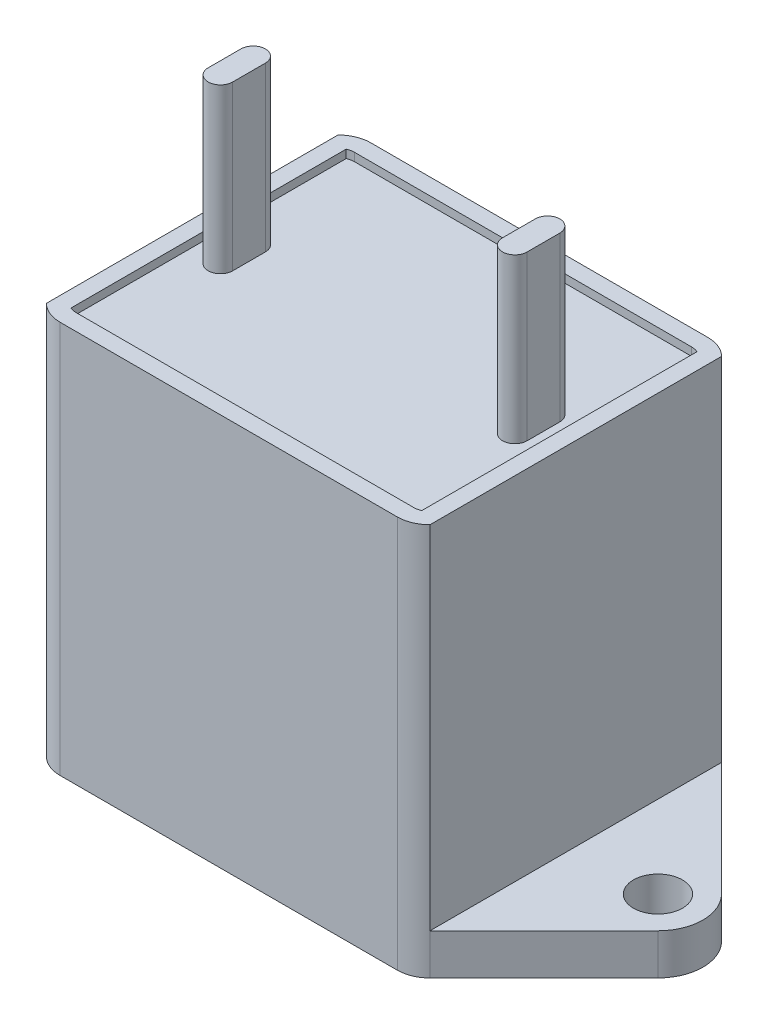
from build123d import *

# Parameters (mm, degrees)
SKETCH1_R           = 2.75
SKETCH1_R_2         = 1.5
BOSS_EXTRUDE1_DEPTH = 2.5
FILLET1_R           = 2
BOSS_EXTRUDE2_START = 21.5
BOSS_EXTRUDE2_DEPTH = 21.5
CUT_EXTRUDE1_DEPTH  = 0.5
BOSS_EXTRUDE3_DEPTH = 10


with BuildPart() as part:
    # Sketch1 → Boss-Extrude1 (new body)
    # profile 1 of 3: a face of its own
    with BuildSketch(Plane(origin=(0, 0, 0), x_dir=(1, 0, 0), z_dir=(0, 1, 0))):
        with BuildLine():
            Line((11.139087297, 9.5), (-11.139087297, 9.5))
            Line((-11.139087297, 9.5), (-18.694543648, 1.944543648))
            ThreePointArc((-18.694543648, 1.944543648), (-15.697620561, 2.540668714), (-14, 0))
            ThreePointArc((-14, 0), (-15.697620561, -2.540668714), (-18.694543648, -1.944543648))
            Line((-18.694543648, -1.944543648), (-11.139087297, -9.5))
            Line((-11.139087297, -9.5), (11.139087297, -9.5))
            Line((11.139087297, -9.5), (18.694543648, -1.944543648))
            ThreePointArc((18.694543648, -1.944543648), (14, 0), (18.694543648, 1.944543648))
            Line((18.694543648, 1.944543648), (11.139087297, 9.5))
        make_face()
    # profile 2 of 3: a face of its own
    with BuildSketch(Plane(origin=(0, 0, 0), x_dir=(1, 0, 0), z_dir=(0, 1, 0))):
        with Locations((-16.75, 0)):
            Circle(SKETCH1_R)
        with Locations(Location((-16.75, 0, 0), (0, 0, 270))):
            Circle(SKETCH1_R_2, mode=Mode.SUBTRACT)
    # profile 3 of 3: a face of its own
    with BuildSketch(Plane(origin=(0, 0, 0), x_dir=(1, 0, 0), z_dir=(0, 1, 0))):
        with Locations((16.75, 0)):
            Circle(SKETCH1_R)
        with Locations(Location((16.75, 0, 0), (0, 0, 270))):
            Circle(SKETCH1_R_2, mode=Mode.SUBTRACT)
    extrude(amount=BOSS_EXTRUDE1_DEPTH)

    # Fillet1
    fillet1_edges = [part.edges().sort_by_distance(p)[0] for p in [
        (11.139087297, 1.25, 9.5),
        (-11.139087297, 1.25, 9.5),
        (-11.139087297, 1.25, -9.5),
        (11.139087297, 1.25, -9.5),
    ]]
    fillet(fillet1_edges, radius=FILLET1_R)

    # Sketch3 → Boss-Extrude2 (add)
    with BuildSketch(Plane(origin=(0, 2.5, 0), x_dir=(1, 0, 0), z_dir=(0, 1, 0)).offset(BOSS_EXTRUDE2_START)):
        with BuildLine():
            Line((10.310660172, 9.5), (-10.310660172, 9.5))
            ThreePointArc((-10.310660172, 9.5), (-11.076027037, 9.347759065), (-11.724873734, 8.914213562))
            Line((-11.724873734, 8.914213562), (-11.724873734, -8.914213562))
            ThreePointArc((-11.724873734, -8.914213562), (-11.076027037, -9.347759065), (-10.310660172, -9.5))
            Line((-10.310660172, -9.5), (10.310660172, -9.5))
            ThreePointArc((10.310660172, -9.5), (11.076027037, -9.347759065), (11.724873734, -8.914213562))
            Line((11.724873734, -8.914213562), (11.724873734, 8.914213562))
            ThreePointArc((11.724873734, 8.914213562), (11.076027037, 9.347759065), (10.310660172, 9.5))
        make_face()
    extrude(amount=-BOSS_EXTRUDE2_DEPTH)

    # Sketch4 → Cut-Extrude1 (cut)
    with BuildSketch(Plane(origin=(0, 24, 0), x_dir=(1, 0, 0), z_dir=(0, 1, 0))):
        with BuildLine():
            Line((10.724873734, -8.410179721), (10.724873734, 8.410179721))
            ThreePointArc((10.724873734, 8.410179721), (10.522580297, 8.47728699), (10.310660172, 8.5))
            Line((10.310660172, 8.5), (-10.310660172, 8.5))
            ThreePointArc((-10.310660172, 8.5), (-10.522580297, 8.47728699), (-10.724873734, 8.410179721))
            Line((-10.724873734, 8.410179721), (-10.724873734, -8.410179721))
            ThreePointArc((-10.724873734, -8.410179721), (-10.522580297, -8.47728699), (-10.310660172, -8.5))
            Line((-10.310660172, -8.5), (10.310660172, -8.5))
            ThreePointArc((10.310660172, -8.5), (10.522580297, -8.47728699), (10.724873734, -8.410179721))
        make_face()
    extrude(amount=-CUT_EXTRUDE1_DEPTH, mode=Mode.SUBTRACT)

    # Sketch5 → Boss-Extrude3 (add)
    with BuildSketch(Plane(origin=(0, 23.5, 0), x_dir=(1, 0, 0), z_dir=(0, 1, 0))):
        with BuildLine():
            Line((-8.25, 1), (-8.25, -1))
            ThreePointArc((-8.25, -1), (-9, -1.75), (-9.75, -1))
            Line((-9.75, -1), (-9.75, 1))
            ThreePointArc((-9.75, 1), (-9, 1.75), (-8.25, 1))
        make_face()
        with BuildLine():
            Line((8.25, 1), (8.25, -1))
            ThreePointArc((8.25, -1), (9, -1.75), (9.75, -1))
            Line((9.75, -1), (9.75, 1))
            ThreePointArc((9.75, 1), (9, 1.75), (8.25, 1))
        make_face()
    extrude(amount=BOSS_EXTRUDE3_DEPTH)


solid = part.part
